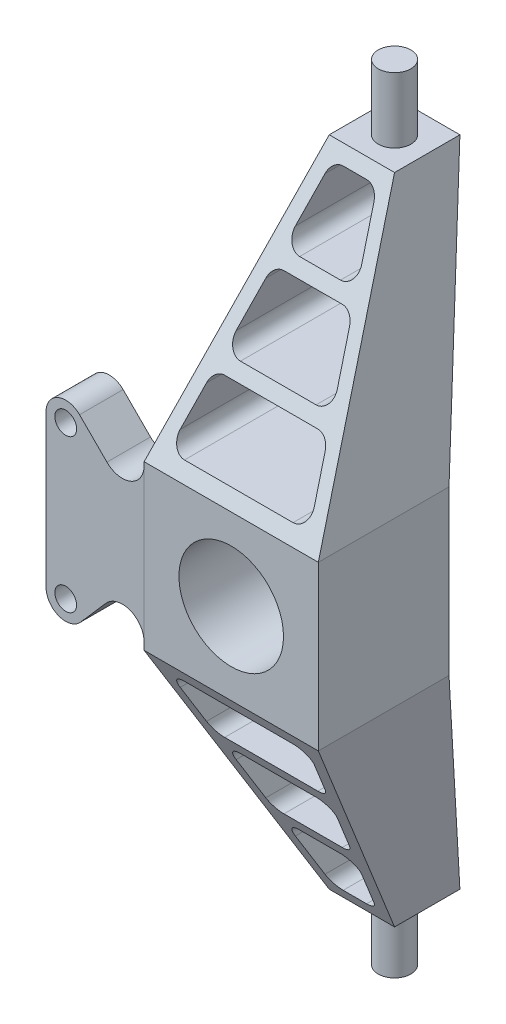
from build123d import *

# Parameters (mm, degrees)
BOSS_EXTRUDE1_DEPTH     = 20
CUT_EXTRUDE1_DEPTH      = 90.721792225
CUT_EXTRUDE1_DEPTH_BACK = 90.721792225
SKETCH2_R               = 12
SKETCH3_R               = 2.5
BOSS_EXTRUDE2_DEPTH     = 10
SKETCH5_R               = 3.75
BOSS_EXTRUDE3_DEPTH     = 15
CUT_EXTRUDE2_DEPTH      = 110.230261375
CUT_EXTRUDE3_DEPTH      = 104.953114431


with BuildPart() as part:
    # Sketch1 → Boss-Extrude1 (new, symmetric)
    with BuildSketch(Plane(origin=(0, 0, 0), x_dir=(0, 0, -1), z_dir=(1, 0, 0))):
        Polygon((-15, -18.75), (-15, 18.75), (15, 75), (30, 75), (15, 18.75), (15, -18.75), (30, -75), (15, -75), align=None)
    extrude(amount=BOSS_EXTRUDE1_DEPTH, both=True)

    # Sketch2 → Cut-Extrude1 (cut, two sides: drawn at the far end of the back side and taken through both)
    with BuildSketch(Plane.XY.offset(15).offset(-CUT_EXTRUDE1_DEPTH_BACK)):
        Circle(SKETCH2_R)
    extrude(amount=CUT_EXTRUDE1_DEPTH + CUT_EXTRUDE1_DEPTH_BACK, mode=Mode.SUBTRACT)

    # Sketch5 → Boss-Extrude3 (add)
    with BuildSketch(Plane(origin=(0, 75, 0), x_dir=(1, 0, 0), z_dir=(0, 1, 0))):
        with Locations(Location((0, 22.5, 0), (0, 0, 270))):
            Circle(SKETCH5_R)
    boss_extrude3 = extrude(amount=BOSS_EXTRUDE3_DEPTH)

    # Mirror1: Boss-Extrude3 across plane
    add(boss_extrude3.mirror(Plane.ZX))

    # Sketch6 → Cut-Extrude2 (cut, symmetric)
    with BuildSketch(Plane.XY.offset(15)):
        Polygon((20, 18.75), (20, 75), (7.5, 75), align=None)
        Polygon((-20, 75), (-20, 18.75), (-7.5, 75), align=None)
    cut_extrude2 = extrude(amount=CUT_EXTRUDE2_DEPTH, both=True, mode=Mode.SUBTRACT)

    # Mirror2: Cut-Extrude2 across plane
    add(cut_extrude2.mirror(Plane.ZX), mode=Mode.SUBTRACT)

    # Sketch7 → Cut-Extrude3 (cut, symmetric)
    with BuildSketch(Plane.XY):
        with BuildLine():
            Line((-12.46474814, 22), (12.46474814, 22))
            ThreePointArc((12.46474814, 22), (14.804873576, 23.122817819), (15.39330932, 25.650791373))
            Line((15.39330932, 25.650791373), (13.615531542, 33.650791373))
            ThreePointArc((13.615531542, 33.650791373), (12.564152543, 35.340125437), (10.686970362, 36))
            Line((10.686970362, 36), (-10.686970362, 36))
            ThreePointArc((-10.686970362, 36), (-12.564152543, 35.340125437), (-13.615531542, 33.650791373))
            Line((-13.615531542, 33.650791373), (-15.39330932, 25.650791373))
            ThreePointArc((-15.39330932, 25.650791373), (-14.804873576, 23.122817819), (-12.46474814, 22))
        make_face()
        with BuildLine():
            Line((2.686970362, 72), (-2.686970362, 72))
            ThreePointArc((-2.686970362, 72), (-4.564152543, 71.340125437), (-5.615531542, 69.650791373))
            Line((-5.615531542, 69.650791373), (-7.615531542, 60.650791373))
            ThreePointArc((-7.615531542, 60.650791373), (-7.027095799, 58.122817819), (-4.686970362, 57))
            Line((-4.686970362, 57), (4.686970362, 57))
            ThreePointArc((4.686970362, 57), (7.027095799, 58.122817819), (7.615531542, 60.650791373))
            Line((7.615531542, 60.650791373), (5.615531542, 69.650791373))
            ThreePointArc((5.615531542, 69.650791373), (4.564152543, 71.340125437), (2.686970362, 72))
        make_face()
        with BuildLine():
            Line((-8.686970362, 39), (8.686970362, 39))
            ThreePointArc((8.686970362, 39), (11.027095799, 40.122817819), (11.615531542, 42.650791373))
            Line((11.615531542, 42.650791373), (9.615531542, 51.650791373))
            ThreePointArc((9.615531542, 51.650791373), (8.564152543, 53.340125437), (6.686970362, 54))
            Line((6.686970362, 54), (-6.686970362, 54))
            ThreePointArc((-6.686970362, 54), (-8.564152543, 53.340125437), (-9.615531542, 51.650791373))
            Line((-9.615531542, 51.650791373), (-11.615531542, 42.650791373))
            ThreePointArc((-11.615531542, 42.650791373), (-11.027095799, 40.122817819), (-8.686970362, 39))
        make_face()
    cut_extrude3 = extrude(amount=CUT_EXTRUDE3_DEPTH, both=True, mode=Mode.SUBTRACT)

    # Mirror3: Cut-Extrude3 across plane
    add(cut_extrude3.mirror(Plane.ZX), mode=Mode.SUBTRACT)


with BuildPart() as body_2:
    # Sketch3 → Boss-Extrude2 (new body)
    with BuildSketch(Plane.XY.offset(15)):
        with BuildLine():
            ThreePointArc((-20, 17.935028843), (-23.086582838, 13.31563118), (-28.535533906, 14.399494937))
            Line((-28.535533906, 14.399494937), (-34.818019485, 20.681980515))
            ThreePointArc((-34.818019485, 20.681980515), (-39.722075446, 21.657457896), (-42.5, 17.5))
            Line((-42.5, 17.5), (-42.5, -17.5))
            ThreePointArc((-42.5, -17.5), (-39.582065715, -21.712726916), (-34.61241419, -20.462138143))
            Line((-34.61241419, -20.462138143), (-28.763984233, -13.773706554))
            ThreePointArc((-28.763984233, -13.773706554), (-23.242149205, -12.384163473), (-20, -17.064971157))
            Line((-20, -17.064971157), (-20, 17.935028843))
        make_face()
        with Locations((-38, -17.5)):
            Circle(SKETCH3_R, mode=Mode.SUBTRACT)
        with Locations((-38, 17.5)):
            Circle(SKETCH3_R, mode=Mode.SUBTRACT)
    extrude(amount=-BOSS_EXTRUDE2_DEPTH)


solid = Compound([part.part, body_2.part])
